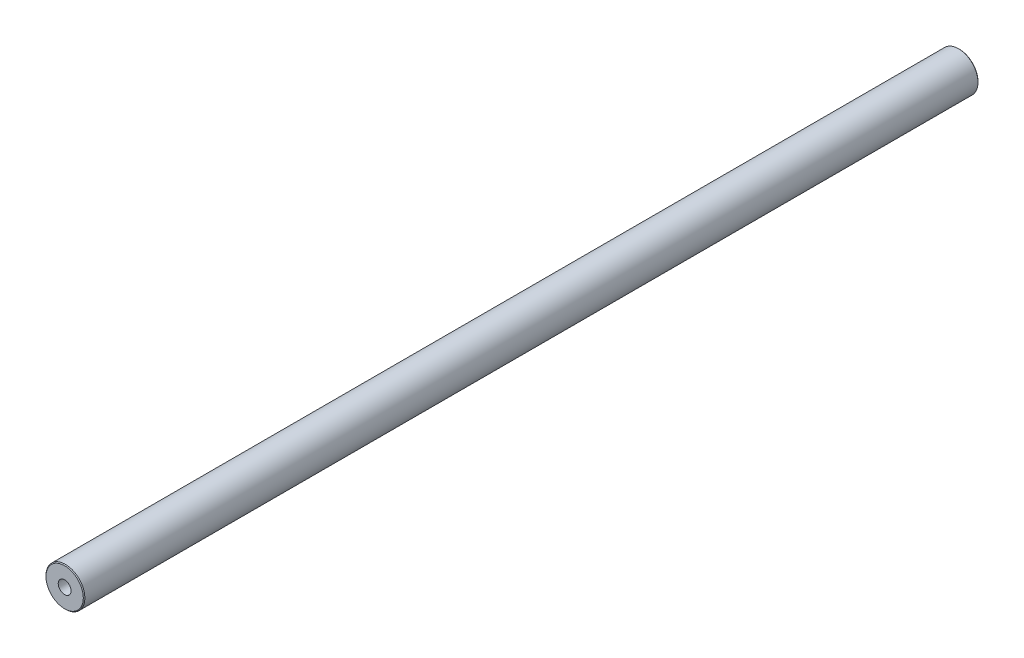
from build123d import *

# Parameters (mm, degrees)
SKETCH_1_R      = 5
EXTRUDE_1_DEPTH = 115
CHAMFER_1_SIZE  = 0.2


with BuildPart() as part:
    # ｽｹｯﾁ1 → ﾎﾞｽ - 押し出し1 (new, symmetric)
    with BuildSketch(Plane.XY):
        Circle(SKETCH_1_R)
    extrude(amount=EXTRUDE_1_DEPTH, both=True)

    # ｽｹｯﾁ3 → M4x0.7 ねじ穴1 (revolve, cut)
    with BuildSketch(Plane(origin=(0, 0, 115), x_dir=(0, -1, 0), z_dir=(1, 0, 0))):
        Polygon((0, 0), (0, 12.491420021), (1.65, 11.5), (1.65, 0), align=None)
    m4x0_7_1 = revolve(axis=Axis((0, 0, 121.35), (0, 0, -1)), mode=Mode.SUBTRACT)

    # ﾐﾗｰ1: M4x0.7 ねじ穴1 across plane
    add(m4x0_7_1.mirror(Plane.XY), mode=Mode.SUBTRACT)

    # 面取り1
    chamfer_1_edges = [part.edges().sort_by_distance(p)[0] for p in [
        (-5, 0, -115),
        (-5, 0, 115),
    ]]
    chamfer(chamfer_1_edges, length=CHAMFER_1_SIZE)


solid = part.part
